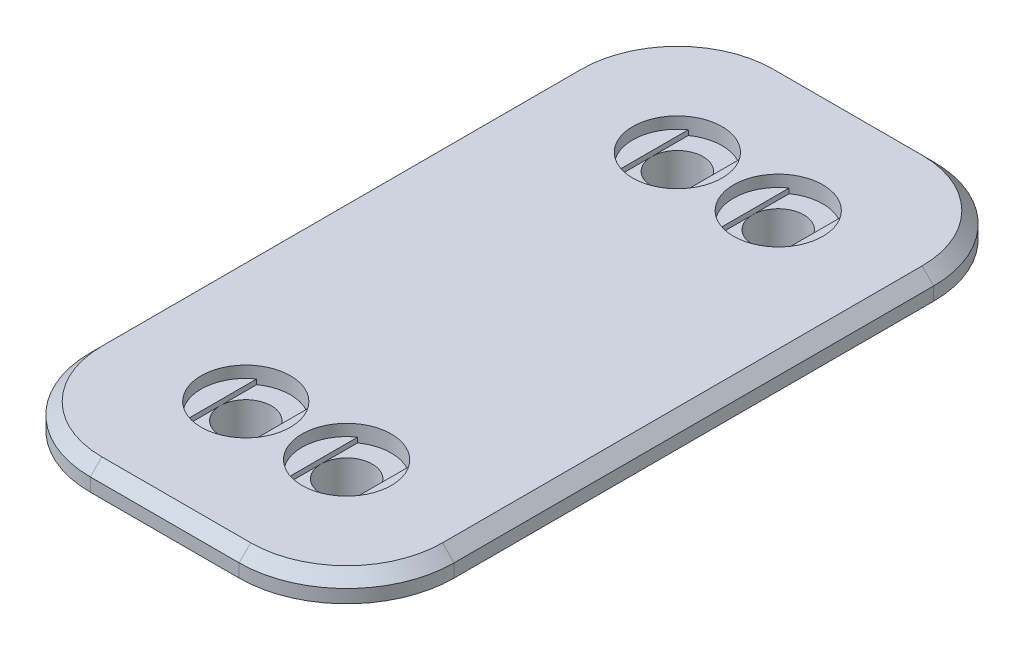
from build123d import *

# Parameters (mm, degrees)
BOSS_EXTRUDE1_START = 0.2
BOSS_EXTRUDE1_DEPTH = 2.3
BOSS_EXTRUDE2_DEPTH = 1.5
SKETCH3_R           = 1.55
CUT_EXTRUDE1_DEPTH  = 25.009164917
CHAMFER1_SIZE       = 0.7
FILLET1_R           = 0.6
SKETCH4_R           = 2.7
CUT_EXTRUDE2_DEPTH  = 1
BOSS_EXTRUDE3_START = 0.3
BOSS_EXTRUDE3_DEPTH = 0.3


with BuildPart() as part:
    # Sketch1 → Boss-Extrude1 (new body)
    with BuildSketch(Plane(origin=(0, 0, 0), x_dir=(1, 0, 0), z_dir=(0, 1, 0)).offset(BOSS_EXTRUDE1_START)):
        with BuildLine():
            Line((5.6, -14.5), (5.6, 14.5))
            ThreePointArc((5.6, 14.5), (5.277817459, 15.277817459), (4.5, 15.6))
            Line((4.5, 15.6), (-4.5, 15.6))
            ThreePointArc((-4.5, 15.6), (-5.277817459, 15.277817459), (-5.6, 14.5))
            Line((-5.6, 14.5), (-5.6, -14.5))
            ThreePointArc((-5.6, -14.5), (-5.277817459, -15.277817459), (-4.5, -15.6))
            Line((-4.5, -15.6), (4.5, -15.6))
            ThreePointArc((4.5, -15.6), (5.277817459, -15.277817459), (5.6, -14.5))
        make_face()
    extrude(amount=BOSS_EXTRUDE1_DEPTH)

    # Sketch2 → Boss-Extrude2 (add)
    with BuildSketch(Plane(origin=(0, 2.5, 0), x_dir=(1, 0, 0), z_dir=(0, 1, 0))):
        with BuildLine():
            Line((-4.5, -21), (4.5, -21))
            ThreePointArc((4.5, -21), (9.096194078, -19.096194078), (11, -14.5))
            Line((11, -14.5), (11, 14.5))
            ThreePointArc((11, 14.5), (9.096194078, 19.096194078), (4.5, 21))
            Line((4.5, 21), (-4.5, 21))
            ThreePointArc((-4.5, 21), (-9.096194078, 19.096194078), (-11, 14.5))
            Line((-11, 14.5), (-11, -14.5))
            ThreePointArc((-11, -14.5), (-9.096194078, -19.096194078), (-4.5, -21))
        make_face()
    extrude(amount=BOSS_EXTRUDE2_DEPTH)

    # Sketch3 → Cut-Extrude1 (cut, through all)
    with BuildSketch(Plane(origin=(0, 4, 0), x_dir=(1, 0, 0), z_dir=(0, 1, 0))):
        with Locations(Location((3.05, -13.05, 0), (0, 0, 270))):
            Circle(SKETCH3_R)
        with Locations(Location((3.05, 13.05, 0), (0, 0, 270))):
            Circle(SKETCH3_R)
        with Locations(Location((-3.05, 13.05, 0), (0, 0, 270))):
            Circle(SKETCH3_R)
        with Locations(Location((-3.05, -13.05, 0), (0, 0, 270))):
            Circle(SKETCH3_R)
    extrude(amount=-CUT_EXTRUDE1_DEPTH, mode=Mode.SUBTRACT)

    # Chamfer1
    chamfer1_edges = [part.edges().sort_by_distance(p)[0] for p in [
        (-11, 4, 0),
        (-9.096194078, 4, 19.096194078),
        (0, 4, 21),
        (9.096194078, 4, 19.096194078),
        (11, 4, 0),
        (9.096194078, 4, -19.096194078),
        (0, 4, -21),
        (-9.096194078, 4, -19.096194078),
    ]]
    chamfer(chamfer1_edges, length=CHAMFER1_SIZE)

    # Fillet1
    fillet1_edges = [part.edges().sort_by_distance(p)[0] for p in [
        (0, 0.2, -15.6),
        (5.277817459, 0.2, -15.277817459),
        (5.6, 0.2, 0),
        (5.277817459, 0.2, 15.277817459),
        (0, 0.2, 15.6),
        (-5.277817459, 0.2, 15.277817459),
        (-5.6, 0.2, 0),
        (-5.277817459, 0.2, -15.277817459),
    ]]
    fillet(fillet1_edges, radius=FILLET1_R)

    # Sketch4 → Cut-Extrude2 (cut)
    with BuildSketch(Plane(origin=(0, 4, 0), x_dir=(1, 0, 0), z_dir=(0, 1, 0))):
        with Locations(Location((-3.05, 13.05, 0), (0, 0, 270))):
            Circle(SKETCH4_R)
        with Locations(Location((3.05, 13.05, 0), (0, 0, 270))):
            Circle(SKETCH4_R)
        with Locations(Location((-3.05, -13.05, 0), (0, 0, 270))):
            Circle(SKETCH4_R)
        with Locations(Location((3.05, -13.05, 0), (0, 0, 270))):
            Circle(SKETCH4_R)
    extrude(amount=-CUT_EXTRUDE2_DEPTH, mode=Mode.SUBTRACT)

    # Sketch5 → Boss-Extrude3 (add)
    with BuildSketch(Plane(origin=(0, 3, 0), x_dir=(1, 0, 0), z_dir=(0, 1, 0)).offset(BOSS_EXTRUDE3_START)):
        with BuildLine():
            Line((4.6, 15.260769097), (4.6, 10.839230903))
            ThreePointArc((4.6, 10.839230903), (5.75, 13.05), (4.6, 15.260769097))
        make_face()
        with BuildLine():
            Line((1.5, 15.260769097), (1.5, 10.839230903))
            ThreePointArc((1.5, 10.839230903), (0.35, 13.05), (1.5, 15.260769097))
        make_face()
        with BuildLine():
            Line((-4.6, 15.260769097), (-4.6, 10.839230903))
            ThreePointArc((-4.6, 10.839230903), (-5.75, 13.05), (-4.6, 15.260769097))
        make_face()
        with BuildLine():
            Line((-1.5, 15.260769097), (-1.5, 10.839230903))
            ThreePointArc((-1.5, 10.839230903), (-0.35, 13.05), (-1.5, 15.260769097))
        make_face()
        with BuildLine():
            Line((-4.6, -10.839230903), (-4.6, -15.260769097))
            ThreePointArc((-4.6, -15.260769097), (-5.75, -13.05), (-4.6, -10.839230903))
        make_face()
        with BuildLine():
            Line((-1.5, -10.839230903), (-1.5, -15.260769097))
            ThreePointArc((-1.5, -15.260769097), (-0.35, -13.05), (-1.5, -10.839230903))
        make_face()
        with BuildLine():
            Line((1.5, -10.839230903), (1.5, -15.260769097))
            ThreePointArc((1.5, -15.260769097), (0.35, -13.05), (1.5, -10.839230903))
        make_face()
        with BuildLine():
            Line((4.6, -10.839230903), (4.6, -15.260769097))
            ThreePointArc((4.6, -15.260769097), (5.75, -13.05), (4.6, -10.839230903))
        make_face()
    extrude(amount=-BOSS_EXTRUDE3_DEPTH)


solid = part.part
